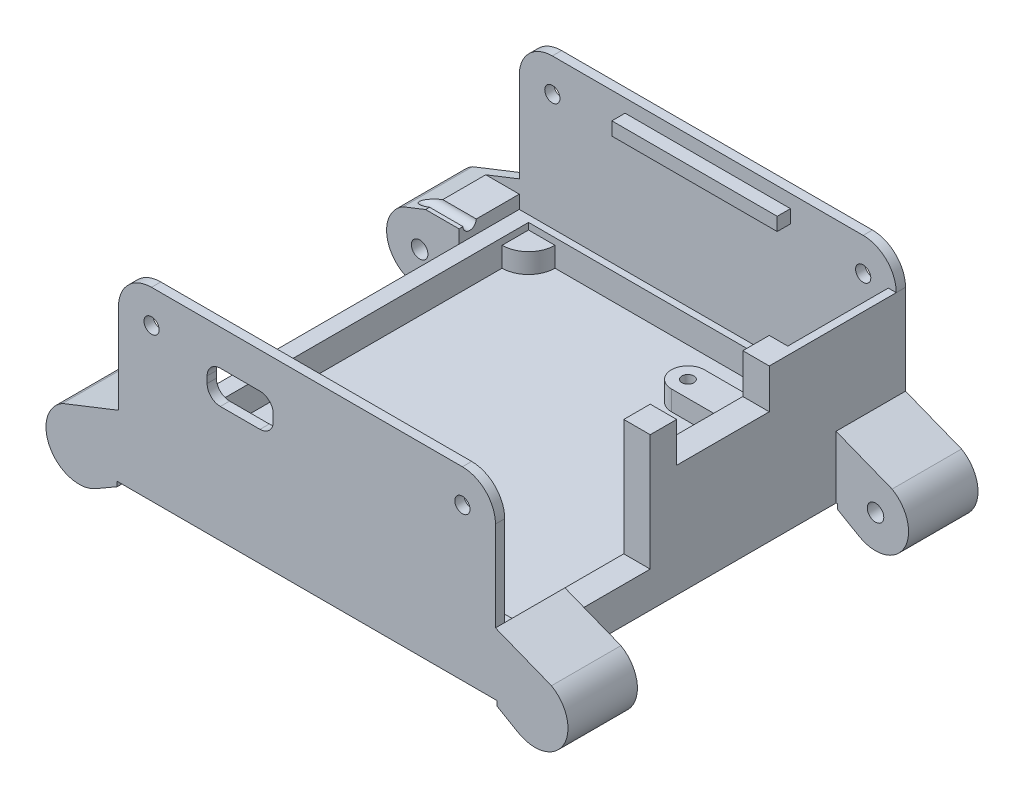
from build123d import *

# Parameters (mm, degrees)
SKETCH1_W                = 57
SKETCH1_H                = 62
BOSS_EXTRUDE1_DEPTH      = 6
SKETCH4_W                = 50.6
SKETCH4_H                = 55.6
CUT_EXTRUDE1_DEPTH       = 4
BOSS_EXTRUDE2_DEPTH      = 3
SKETCH6_R                = 0.9
CUT_EXTRUDE2_DEPTH       = 3
BOSS_EXTRUDE3_DEPTH      = 10.5
SKETCH8_R                = 1.25
CUT_EXTRUDE3_DEPTH       = 7.5
CUT_EXTRUDE4_START       = -7.5
SKETCH9_R                = 1.25
CUT_EXTRUDE4_DEPTH       = 7.5
SKETCH10_W               = 57
SKETCH10_H               = 1.4
BOSS_EXTRUDE4_DEPTH      = 22.6
FILLET2_R                = 5
CUT_EXTRUDE8_DEPTH       = 57.79766999
CUT_EXTRUDE8_DEPTH_BACK  = 57.79766999
SKETCH15_W               = 10
SKETCH15_H               = 3.9
SKETCH18_W               = 10
SKETCH18_H               = 5
CUT_EXTRUDE10_DEPTH      = 78.76718663
FILLET3_R                = 2
CUT_EXTRUDE12_DEPTH      = 80.987993526
SKETCH19_R               = 1.15
CUT_EXTRUDE11_DEPTH      = 79.86301615
SKETCH21_W               = 7.2
SKETCH21_H               = 3
CUT_EXTRUDE13_DEPTH      = 57.79766999
CUT_EXTRUDE14_DEPTH      = 58.761365256
CUT_EXTRUDE14_DEPTH_BACK = 0.6
SKETCH22_W               = 57.4
SKETCH22_H               = 62
BOSS_EXTRUDE6_DEPTH      = 17.6
SKETCH24_W               = 4
SKETCH24_H               = 14
CUT_EXTRUDE15_DEPTH      = 6
SKETCH25_W               = 25
SKETCH25_H               = 2
BOSS_EXTRUDE7_DEPTH      = 2


with BuildPart() as part:
    # Sketch1 → Boss-Extrude1 (new body)
    with BuildSketch(Plane(origin=(0, 0, 0), x_dir=(1, 0, 0), z_dir=(0, 1, 0))):
        Rectangle(SKETCH1_W, SKETCH1_H)
    extrude(amount=BOSS_EXTRUDE1_DEPTH)

    # Sketch4 → Cut-Extrude1 (cut)
    with BuildSketch(Plane(origin=(0, 6, 0), x_dir=(1, 0, 0), z_dir=(0, 1, 0))):
        with Locations((-0.8, 0.8)):
            Rectangle(SKETCH4_W, SKETCH4_H)
    extrude(amount=-CUT_EXTRUDE1_DEPTH, mode=Mode.SUBTRACT)

    # Sketch5 → Boss-Extrude2 (add)
    with BuildSketch(Plane(origin=(0, 2, 0), x_dir=(1, 0, 0), z_dir=(0, 1, 0))):
        with BuildLine():
            Line((-26.1, -27), (-18.1, -27))
            Line((-18.1, -27), (24.5, -27))
            Line((24.5, -27), (24.5, -23.5))
            Line((24.5, -23.5), (-18.1, -23.5))
            ThreePointArc((-18.1, -23.5), (-18.832233047, -21.732233047), (-20.6, -21))
            Line((-20.6, -21), (-26.1, -21))
            Line((-26.1, -21), (-26.1, -27))
        make_face()
        with BuildLine():
            Line((24.5, 23.6), (5.5, 23.6))
            ThreePointArc((5.5, 23.6), (3, 21.1), (5.5, 18.6))
            Line((5.5, 18.6), (24.5, 18.6))
            Line((24.5, 18.6), (24.5, 23.6))
        make_face()
        with BuildLine():
            Line((-26.1, 24.6), (-26.1, 28.6))
            Line((-26.1, 28.6), (-22.1, 28.6))
            ThreePointArc((-22.1, 28.6), (-23.271572875, 25.771572875), (-26.1, 24.6))
        make_face()
    extrude(amount=BOSS_EXTRUDE2_DEPTH)

    # Sketch6 → Cut-Extrude2 (cut)
    with BuildSketch(Plane(origin=(0, 5, 0), x_dir=(1, 0, 0), z_dir=(0, 1, 0))):
        with Locations(Location((5.5, 21.1, 0), (0, 0, 270))):
            Circle(SKETCH6_R)
        with Locations(Location((-21.1, -24.5, 0), (0, 0, 270))):
            Circle(SKETCH6_R)
    extrude(amount=-CUT_EXTRUDE2_DEPTH, mode=Mode.SUBTRACT)

    # Sketch7 → Boss-Extrude3 (add)
    with BuildSketch(Plane.XY.offset(31)):
        with BuildLine():
            Line((-28.5, 0), (-31.964101615, -2))
            ThreePointArc((-31.964101615, -2), (-38.794228634, -0.169872981), (-36.964101615, 6.660254038))
            Line((-36.964101615, 6.660254038), (-28.5, 10))
            Line((-28.5, 10), (-28.5, 0))
        make_face()
        with BuildLine():
            Line((36.964101615, 6.660254038), (28.5, 10))
            Line((28.5, 10), (28.5, 0))
            Line((28.5, 0), (31.964101615, -2))
            ThreePointArc((31.964101615, -2), (38.794228634, -0.169872981), (36.964101615, 6.660254038))
        make_face()
    boss_extrude3 = extrude(amount=-BOSS_EXTRUDE3_DEPTH)

    # Mirror4: Boss-Extrude3 across plane
    add(boss_extrude3.mirror(Plane.XY))

    # Sketch8 → Cut-Extrude3 (cut)
    with BuildSketch(Plane(origin=(0, 0, 20.5), x_dir=(-1, 0, 0), z_dir=(0, 0, -1))):
        with Locations((34.464101615, 2.330127019)):
            Circle(SKETCH8_R)
        with Locations((-34.464101615, 2.330127019)):
            Circle(SKETCH8_R)
    extrude(amount=-CUT_EXTRUDE3_DEPTH, mode=Mode.SUBTRACT)

    # Sketch9 → Cut-Extrude4 (cut)
    with BuildSketch(Plane.XY.offset(-20.5).offset(CUT_EXTRUDE4_START)):
        with Locations(Location((-34.464101615, 2.330127019, 0), (0, 0, 180))):
            Circle(SKETCH9_R)
        with Locations(Location((34.464101615, 2.330127019, 0), (0, 0, 180))):
            Circle(SKETCH9_R)
    extrude(amount=CUT_EXTRUDE4_DEPTH, mode=Mode.SUBTRACT)

    # Sketch10 → Boss-Extrude4 (add)
    with BuildSketch(Plane(origin=(0, 6, 0), x_dir=(1, 0, 0), z_dir=(0, 1, 0))):
        with Locations((0, 30.3)):
            Rectangle(SKETCH10_W, SKETCH10_H)
        with Locations((0, -30.3)):
            Rectangle(SKETCH10_W, SKETCH10_H)
    extrude(amount=BOSS_EXTRUDE4_DEPTH)

    # Fillet2
    fillet2_edges = [part.edges().sort_by_distance(p)[0] for p in [
        (-28.5, 28.6, -30.3),
        (28.5, 28.6, -30.3),
        (-28.5, 28.6, 30.3),
        (28.5, 28.6, 30.3),
    ]]
    fillet(fillet2_edges, radius=FILLET2_R)

    # Sketch15 → Cut-Extrude8 (cut, two sides: drawn at the far end of the back side and taken through both)
    with BuildSketch(Plane(origin=(0, 2, 0), x_dir=(1, 0, 0), z_dir=(0, 1, 0)).offset(-CUT_EXTRUDE8_DEPTH_BACK)):
        with Locations((22.3, 25.55)):
            Rectangle(SKETCH15_W, SKETCH15_H)
    extrude(amount=CUT_EXTRUDE8_DEPTH + CUT_EXTRUDE8_DEPTH_BACK, mode=Mode.SUBTRACT)

    # Sketch18 → Cut-Extrude10 (cut, through all)
    with BuildSketch(Plane(origin=(0, 0, 29.6), x_dir=(-1, 0, 0), z_dir=(0, 0, -1))):
        with Locations((10.1, 20.7)):
            Rectangle(SKETCH18_W, SKETCH18_H)
    extrude(amount=-CUT_EXTRUDE10_DEPTH, mode=Mode.SUBTRACT)

    # Fillet3
    fillet3_edges = [part.edges().sort_by_distance(p)[0] for p in [
        (-5.1, 18.2, 30.3),
        (-5.1, 23.2, 30.3),
        (-15.1, 23.2, 30.3),
        (-15.1, 18.2, 30.3),
    ]]
    fillet(fillet3_edges, radius=FILLET3_R)

    # Sketch20 → Cut-Extrude12 (cut, through all)
    with BuildSketch(Plane(origin=(-28.5, 0, 0), x_dir=(0, 0, -1), z_dir=(1, 0, 0))):
        with BuildLine():
            Line((29.6, 8), (29.6, 10))
            Line((29.6, 10), (20.5, 10))
            Line((20.5, 10), (20.5, 8))
            Line((20.5, 8), (21.1, 8))
            ThreePointArc((21.1, 8), (22.1, 7), (23.1, 8))
            Line((23.1, 8), (29.6, 8))
        make_face()
    extrude(amount=-CUT_EXTRUDE12_DEPTH, mode=Mode.SUBTRACT)

    # Sketch19 → Cut-Extrude11 (cut, through all)
    with BuildSketch(Plane.XY.offset(31)):
        with Locations((-23.5, 23.6)):
            Circle(SKETCH19_R)
        with Locations((23.5, 23.6)):
            Circle(SKETCH19_R)
    extrude(amount=-CUT_EXTRUDE11_DEPTH, mode=Mode.SUBTRACT)

    # Sketch21 → Cut-Extrude13 (cut, through all)
    with BuildSketch(Plane(origin=(0, 2, 0), x_dir=(1, 0, 0), z_dir=(0, 1, 0))):
        with Locations((20.9, 22.1)):
            Rectangle(SKETCH21_W, SKETCH21_H)
    extrude(amount=-CUT_EXTRUDE13_DEPTH, mode=Mode.SUBTRACT)

    # Sketch22 → Cut-Extrude14 (cut, two sides: drawn at the far end of the back side and taken through both)
    with BuildSketch(Plane.XZ.offset(-CUT_EXTRUDE14_DEPTH_BACK)):
        Rectangle(SKETCH22_W, SKETCH22_H)
    extrude(amount=CUT_EXTRUDE14_DEPTH + CUT_EXTRUDE14_DEPTH_BACK, mode=Mode.SUBTRACT)

    # Sketch23 → Boss-Extrude6 (add)
    with BuildSketch(Plane(origin=(0, 6, 0), x_dir=(1, 0, 0), z_dir=(0, 1, 0))):
        Polygon((24.5, -7.6), (28.5, -7.6), (28.5, 29.6), (27.3, 29.6), (27.3, 14.4), (24.5, 14.4), align=None)
    extrude(amount=BOSS_EXTRUDE6_DEPTH)

    # Sketch24 → Cut-Extrude15 (cut)
    with BuildSketch(Plane(origin=(0, 23.6, 0), x_dir=(1, 0, 0), z_dir=(0, 1, 0))):
        with Locations((26.5, 3.4)):
            Rectangle(SKETCH24_W, SKETCH24_H)
    extrude(amount=-CUT_EXTRUDE15_DEPTH, mode=Mode.SUBTRACT)

    # Sketch25 → Boss-Extrude7 (add)
    with BuildSketch(Plane.XY.offset(-29.6)):
        with Locations((0, 25.6)):
            Rectangle(SKETCH25_W, SKETCH25_H)
    extrude(amount=BOSS_EXTRUDE7_DEPTH)


solid = part.part
